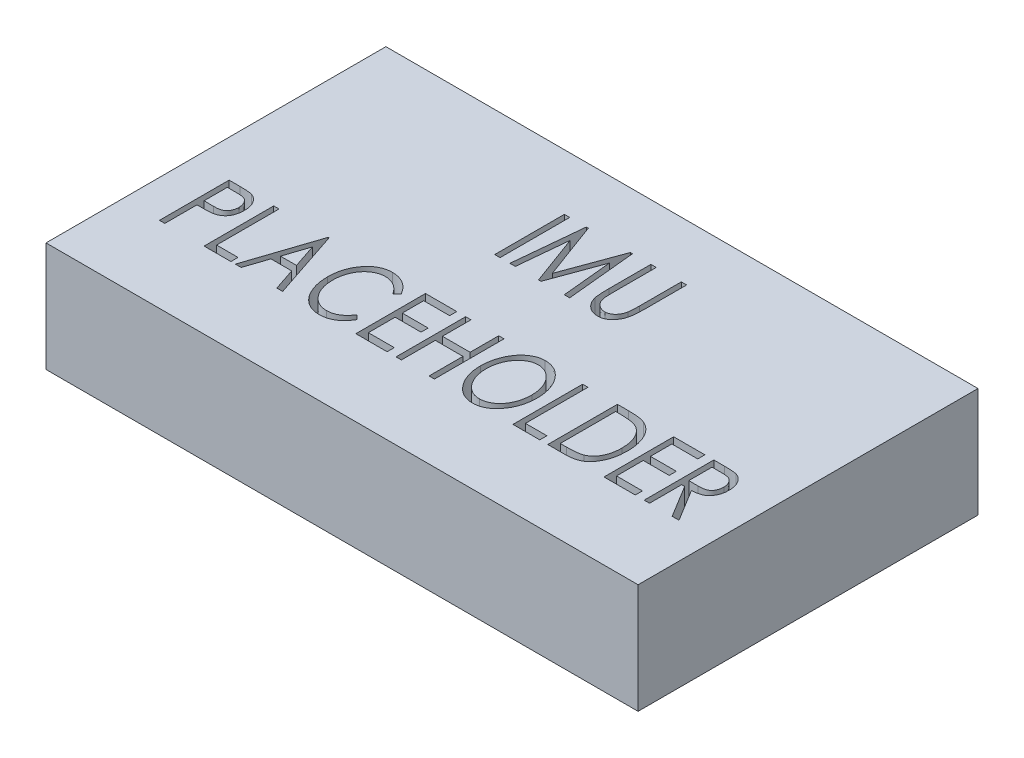
from build123d import *

# Parameters (mm, degrees)
SKETCH1_W           = 27
SKETCH1_H           = 15.5
BOSS_EXTRUDE1_DEPTH = 5
SKETCH2_W           = 0.244230769
SKETCH2_H           = 3.175
CUT_EXTRUDE2_DEPTH  = 2


with BuildPart() as part:
    # Sketch1 → Boss-Extrude1 (new body)
    with BuildSketch(Plane(origin=(0, 0, 0), x_dir=(1, 0, 0), z_dir=(0, 1, 0))):
        Rectangle(SKETCH1_W, SKETCH1_H)
    extrude(amount=BOSS_EXTRUDE1_DEPTH)

    # Sketch2 → Cut-Extrude2 (cut)
    # profile 1 of 14: a face of its own
    with BuildSketch(Plane(origin=(0, 5, 0), x_dir=(1, 0, 0), z_dir=(0, 1, 0))):
        with Locations((-2.686538462, 3.608407858)):
            Rectangle(SKETCH2_W, SKETCH2_H)
    # profile 2 of 14: a face of its own
    with BuildSketch(Plane(origin=(0, 5, 0), x_dir=(1, 0, 0), z_dir=(0, 1, 0))):
        Polygon((-2.116666667, 2.020907858), (-1.808198117, 5.195907858), (-1.715975561, 5.195907858), (-0.753044872, 2.590779652), (0.204161659, 5.195907858), (0.300200321, 5.195907858), (0.610576923, 2.020907858), (0.365710136, 2.020907858), (0.142467949, 4.300395037), (-0.69453125, 2.020907858), (-0.806470353, 2.020907858), (-1.648557692, 4.300395037), (-1.869891827, 2.020907858), align=None)
    # profile 3 of 14: a face of its own
    with BuildSketch(Plane(origin=(0, 5, 0), x_dir=(1, 0, 0), z_dir=(0, 1, 0))):
        with BuildLine():
            Line((1.13974359, 5.195907858), (1.383974359, 5.195907858))
            Line((1.383974359, 5.195907858), (1.383974359, 3.293579132))
            add(Edge.make_bspline(
                [(1.383974359, 3.293579132), (1.383901601, 3.266653956), (1.38376353, 3.215558796), (1.38468575, 3.142844249), (1.384960193, 3.078172474), (1.386552348, 3.021365839), (1.387412081, 2.972579182), (1.389649815, 2.931685992), (1.391053297, 2.898762782), (1.393220111, 2.879525012), (1.394150641, 2.871263426)],
                knots=[0, 0, 0, 0, 1.529155413, 2.901835916, 4.130035505, 5.201918895, 6.129357308, 6.900801451, 7.527953438, 8, 8, 8, 8], degree=3))
            add(Edge.make_bspline(
                [(1.394150641, 2.871263426), (1.397638099, 2.841497304), (1.404389282, 2.783874673), (1.422944611, 2.701921793), (1.447056836, 2.627238344), (1.477385635, 2.559486969), (1.516615291, 2.49843915), (1.563774858, 2.442662014), (1.62086562, 2.392941459), (1.68457317, 2.348283085), (1.753537826, 2.312078813), (1.823825711, 2.284865947), (1.894539001, 2.268027358), (1.941887209, 2.266094274), (1.965294471, 2.265138627)],
                knots=[0, 0, 0, 0, 1.17424895, 2.273165188, 3.287688819, 4.247239277, 5.174089139, 6.123362021, 7.100708873, 8.13362008, 9.16716642, 10.145784664, 11.083342199, 12, 12, 12, 12], degree=3))
            add(Edge.make_bspline(
                [(1.965294471, 2.265138627), (1.985482607, 2.266123244), (2.025995245, 2.268099129), (2.086156794, 2.280164509), (2.144388713, 2.30190322), (2.201341536, 2.330306638), (2.254622254, 2.367148599), (2.304463064, 2.410144868), (2.348770019, 2.460142783), (2.38908455, 2.515909251), (2.42521768, 2.577817865), (2.454135403, 2.64683626), (2.480652, 2.721066018), (2.492279421, 2.773577992), (2.498277244, 2.80066547)],
                knots=[0, 0, 0, 0, 0.887425244, 1.780844861, 2.682628156, 3.611715659, 4.570365192, 5.521242685, 6.497608697, 7.498294315, 8.541734898, 9.639015203, 10.782123018, 12, 12, 12, 12], degree=3))
            add(Edge.make_bspline(
                [(2.498277244, 2.80066547), (2.500234115, 2.811892449), (2.504615686, 2.837030439), (2.510663698, 2.878947065), (2.51350359, 2.928936188), (2.518033307, 2.986534558), (2.519784163, 3.052110555), (2.523118075, 3.125641188), (2.522927047, 3.207084936), (2.523446561, 3.263899797), (2.523717949, 3.293579132)],
                knots=[0, 0, 0, 0, 0.553535321, 1.239404254, 2.05518318, 2.983939725, 4.045295254, 5.240417841, 6.558430678, 8, 8, 8, 8], degree=3))
            Line((2.523717949, 3.293579132), (2.523717949, 5.195907858))
            Line((2.523717949, 5.195907858), (2.767948718, 5.195907858))
            Line((2.767948718, 5.195907858), (2.767948718, 3.278314708))
            add(Edge.make_bspline(
                [(2.767948718, 3.278314708), (2.767594153, 3.243757309), (2.766902337, 3.176330113), (2.764725376, 3.077489597), (2.759526419, 2.983761389), (2.75252082, 2.895122862), (2.744016294, 2.811681062), (2.732050959, 2.733338093), (2.71999952, 2.659737959), (2.699700711, 2.569506319), (2.66693094, 2.462886029), (2.609521604, 2.343588651), (2.536151615, 2.232788723), (2.463431973, 2.148099074), (2.397611481, 2.087897758), (2.34523872, 2.048284406), (2.29046296, 2.014301465), (2.232895373, 1.98673133), (2.172836127, 1.96594694), (2.110549565, 1.950282872), (2.045474299, 1.941453146), (2.001148753, 1.940155988), (1.978650841, 1.939497601)],
                knots=[0, 0, 0, 0, 1.189495296, 2.320901874, 3.402429694, 4.419879292, 5.381225388, 6.288312168, 7.147249289, 7.947424288, 9.470551633, 10.975160932, 12.486972232, 14.033533548, 14.803182079, 15.553316057, 16.290454294, 17.018287978, 17.745243254, 18.474392565, 19.22566139, 20, 20, 20, 20], degree=3))
            add(Edge.make_bspline(
                [(1.978650841, 1.939497601), (1.954251596, 1.940203216), (1.906373705, 1.941587823), (1.835615718, 1.949721037), (1.767883662, 1.96464499), (1.702238619, 1.984011007), (1.640023716, 2.010677691), (1.57963415, 2.041384587), (1.52312185, 2.079809387), (1.468329122, 2.121844953), (1.417761385, 2.169650135), (1.37106062, 2.221249963), (1.329084566, 2.277022808), (1.290771322, 2.335862825), (1.257606254, 2.399058462), (1.228318357, 2.465443669), (1.204120362, 2.535994068), (1.191378299, 2.584543797), (1.184900841, 2.609224164)],
                knots=[0, 0, 0, 0, 1.040046564, 2.040851474, 3.029716458, 3.992945491, 4.952778378, 5.910567797, 6.875363504, 7.860382118, 8.851185287, 9.836411077, 10.823085881, 11.82307474, 12.825469039, 13.861228841, 14.912750729, 16, 16, 16, 16], degree=3))
            add(Edge.make_bspline(
                [(1.184900841, 2.609224164), (1.181064958, 2.626141417), (1.172725329, 2.662921369), (1.164528043, 2.72358367), (1.156905257, 2.793352238), (1.150660704, 2.872472855), (1.145722611, 2.960690267), (1.14177146, 3.058220269), (1.140125717, 3.165097736), (1.139874538, 3.239517397), (1.13974359, 3.278314708)],
                knots=[0, 0, 0, 0, 0.619449711, 1.346751184, 2.18483435, 3.12705977, 4.181588362, 5.341301494, 6.613936809, 8, 8, 8, 8], degree=3))
            Line((1.13974359, 3.278314708), (1.13974359, 5.195907858))
        make_face()
    # profile 4 of 14: a face of its own
    with BuildSketch(Plane(origin=(0, 5, 0), x_dir=(1, 0, 0), z_dir=(0, 1, 0))):
        with BuildLine():
            Line((-11.804487179, -1.095758809), (-11.311573518, -1.095758809))
            add(Edge.make_bspline(
                [(-11.311573518, -1.095758809), (-11.277650217, -1.0958047), (-11.212760895, -1.095892482), (-11.119681876, -1.098635016), (-11.035067755, -1.102296341), (-10.959151727, -1.107333764), (-10.891827819, -1.113307359), (-10.833341168, -1.121817611), (-10.782956866, -1.130483375), (-10.752878224, -1.139395024), (-10.739157652, -1.143460131)],
                knots=[0, 0, 0, 0, 1.413289242, 2.703374391, 3.879342949, 4.941642004, 5.873291596, 6.693989754, 7.404254793, 8, 8, 8, 8], degree=3))
            add(Edge.make_bspline(
                [(-10.739157652, -1.143460131), (-10.721625909, -1.149453973), (-10.686941343, -1.161312109), (-10.637561439, -1.18552549), (-10.590394978, -1.213373381), (-10.545675887, -1.245978535), (-10.503605399, -1.283289106), (-10.463359562, -1.324358242), (-10.426548805, -1.37081777), (-10.391580391, -1.420740773), (-10.359820606, -1.474608775), (-10.332201755, -1.532218918), (-10.309795105, -1.593312171), (-10.290103095, -1.657495721), (-10.276101852, -1.725281373), (-10.264986145, -1.796346846), (-10.258623845, -1.870734857), (-10.25800678, -1.921510042), (-10.257692308, -1.947386413)],
                knots=[0, 0, 0, 0, 0.884746594, 1.750370786, 2.622729615, 3.500310264, 4.390609716, 5.30783377, 6.244661446, 7.220040901, 8.219286538, 9.229974682, 10.268866035, 11.326756505, 12.435726026, 13.573575987, 14.763430443, 16, 16, 16, 16], degree=3))
            add(Edge.make_bspline(
                [(-10.257692308, -1.947386413), (-10.257973051, -1.97347955), (-10.258521738, -2.024476075), (-10.265315137, -2.099189702), (-10.275020132, -2.170454026), (-10.289931341, -2.238155302), (-10.308181266, -2.302394757), (-10.330503415, -2.363294639), (-10.357068835, -2.420674634), (-10.388464102, -2.473980539), (-10.422824183, -2.523790687), (-10.460271006, -2.569728702), (-10.501149722, -2.611244875), (-10.545169831, -2.648399499), (-10.59256127, -2.680641993), (-10.642396031, -2.709844387), (-10.695895639, -2.733779861), (-10.733120921, -2.746707012), (-10.751878005, -2.753220748)],
                knots=[0, 0, 0, 0, 1.230348438, 2.404597596, 3.535952481, 4.620603023, 5.671397407, 6.683805958, 7.676968664, 8.649426021, 9.598095933, 10.528942615, 11.441124898, 12.342499997, 13.24120863, 14.141695784, 15.06363722, 16, 16, 16, 16], degree=3))
            add(Edge.make_bspline(
                [(-10.751878005, -2.753220748), (-10.767521165, -2.757440407), (-10.801515697, -2.766610251), (-10.857629988, -2.777069907), (-10.922794328, -2.785900375), (-10.997097432, -2.792521765), (-11.080645846, -2.798217663), (-11.173304574, -2.802686278), (-11.275094465, -2.805179278), (-11.345917098, -2.805307438), (-11.382807492, -2.805374194)],
                knots=[0, 0, 0, 0, 0.612409215, 1.330841357, 2.156118473, 3.098102871, 4.150647915, 5.322299054, 6.605227774, 8, 8, 8, 8], degree=3))
            Line((-11.382807492, -2.805374194), (-11.56025641, -2.805374194))
            Line((-11.56025641, -2.805374194), (-11.56025641, -4.270758809))
            Line((-11.56025641, -4.270758809), (-11.804487179, -4.270758809))
            Line((-11.804487179, -4.270758809), (-11.804487179, -1.095758809))
        make_face()
        with BuildLine():
            Line((-11.56025641, -1.421399835), (-11.56025641, -2.479733168))
            Line((-11.56025641, -2.479733168), (-11.135396635, -2.486729362))
            add(Edge.make_bspline(
                [(-11.135396635, -2.486729362), (-11.114613281, -2.486746959), (-11.074502995, -2.48678092), (-11.016416138, -2.483107806), (-10.962699372, -2.479079784), (-10.913221983, -2.472732186), (-10.868302904, -2.464321609), (-10.827240387, -2.455352158), (-10.791072822, -2.442982352), (-10.748280415, -2.425444166), (-10.700664893, -2.39648155), (-10.64938471, -2.353616307), (-10.606349931, -2.30024019), (-10.568604252, -2.240032663), (-10.539444831, -2.172963444), (-10.517290159, -2.101608603), (-10.504595936, -2.026279788), (-10.502822587, -1.974780739), (-10.501923077, -1.948658449)],
                knots=[0, 0, 0, 0, 1.042081371, 2.011137451, 2.917996092, 3.743607318, 4.511095698, 5.210044043, 5.848905295, 6.425539579, 7.526959198, 8.628378818, 9.761072847, 10.950155818, 12.183071426, 13.417453374, 14.690033403, 16, 16, 16, 16], degree=3))
            add(Edge.make_bspline(
                [(-10.501923077, -1.948658449), (-10.502826006, -1.923169692), (-10.504613141, -1.8727207), (-10.517399636, -1.798695877), (-10.539368014, -1.728108192), (-10.568913423, -1.661829696), (-10.605241145, -1.601772987), (-10.647691305, -1.549945371), (-10.695587711, -1.507150858), (-10.741281864, -1.480148624), (-10.781666948, -1.463027254), (-10.816365665, -1.451835028), (-10.855470261, -1.442257012), (-10.899082462, -1.434885742), (-10.947006119, -1.428481786), (-10.999644032, -1.424126187), (-11.05650454, -1.421600937), (-11.095960782, -1.421468275), (-11.116316106, -1.421399835)],
                knots=[0, 0, 0, 0, 1.311348819, 2.595506256, 3.851552363, 5.106555753, 6.32083189, 7.452254181, 8.542153451, 9.608595853, 10.16582827, 10.797158969, 11.48245446, 12.235753575, 13.072011464, 13.969832696, 14.952644476, 16, 16, 16, 16], degree=3))
            Line((-11.116316106, -1.421399835), (-11.56025641, -1.421399835))
        make_face(mode=Mode.SUBTRACT)
    # profile 5 of 14: a face of its own
    with BuildSketch(Plane(origin=(0, 5, 0), x_dir=(1, 0, 0), z_dir=(0, 1, 0))):
        Polygon((-9.769230769, -1.095758809), (-9.525, -1.095758809), (-9.525, -3.945117784), (-8.548076923, -3.945117784), (-8.548076923, -4.270758809), (-9.769230769, -4.270758809), align=None)
    # profile 6 of 14: a face of its own
    with BuildSketch(Plane(origin=(0, 5, 0), x_dir=(1, 0, 0), z_dir=(0, 1, 0))):
        Polygon((-7.245512821, -1.095758809), (-6.187179487, -4.270758809), (-6.453034856, -4.270758809), (-6.792032252, -3.253130604), (-7.739698518, -3.253130604), (-8.078695913, -4.270758809), (-8.344551282, -4.270758809), (-7.286217949, -1.095758809), align=None)
        Polygon((-7.265865385, -1.832267223), (-7.630939503, -2.927489578), (-6.900791266, -2.927489578), align=None, mode=Mode.SUBTRACT)
    # profile 7 of 14: a face of its own
    with BuildSketch(Plane(origin=(0, 5, 0), x_dir=(1, 0, 0), z_dir=(0, 1, 0))):
        with BuildLine():
            Line((-3.378525641, -1.678350957), (-3.571875, -1.869156245))
            add(Edge.make_bspline(
                [(-3.571875, -1.869156245), (-3.598776727, -1.827828197), (-3.651212922, -1.747272565), (-3.742615172, -1.639614452), (-3.842692413, -1.548458011), (-3.949947491, -1.472983585), (-4.063678733, -1.412965938), (-4.183955176, -1.371024746), (-4.309548524, -1.344416564), (-4.395384779, -1.341475841), (-4.438767027, -1.339989578)],
                knots=[0, 0, 0, 0, 1.111525425, 2.166558491, 3.175351395, 4.157123073, 5.11752335, 6.065846558, 7.022465223, 8, 8, 8, 8], degree=3))
            add(Edge.make_bspline(
                [(-4.438767027, -1.339989578), (-4.462756848, -1.340353188), (-4.51048372, -1.341076576), (-4.58121476, -1.350752718), (-4.65066021, -1.364309203), (-4.718666478, -1.384412507), (-4.785166898, -1.409817417), (-4.850833137, -1.44053858), (-4.914606586, -1.477507322), (-4.977041588, -1.519360493), (-5.03651692, -1.566444359), (-5.093191254, -1.61745779), (-5.146832491, -1.671828361), (-5.195728673, -1.7311665), (-5.242413663, -1.793164418), (-5.285102729, -1.859830344), (-5.324341611, -1.93015579), (-5.360027652, -2.004065919), (-5.391615729, -2.081028692), (-5.419871325, -2.160233997), (-5.442625577, -2.242392133), (-5.461552925, -2.326688332), (-5.47699148, -2.413235017), (-5.487752024, -2.502193861), (-5.494247063, -2.593481158), (-5.494875297, -2.655263298), (-5.495192308, -2.686438897)],
                knots=[0, 0, 0, 0, 0.907615735, 1.805668338, 2.698251542, 3.584750363, 4.486668963, 5.391547429, 6.326439657, 7.274845802, 8.235134492, 9.19572507, 10.160699102, 11.123701377, 12.104602389, 13.09764599, 14.118208251, 15.152161779, 16.20308195, 17.26679937, 18.334114781, 19.428523801, 20.537059719, 21.661122186, 22.819789684, 24, 24, 24, 24], degree=3))
            add(Edge.make_bspline(
                [(-5.495192308, -2.686438897), (-5.494507206, -2.733338956), (-5.493164458, -2.825259561), (-5.47761553, -2.959945228), (-5.45496149, -3.088866338), (-5.420498269, -3.211565915), (-5.378389455, -3.328896243), (-5.325784635, -3.440144616), (-5.264087346, -3.545479461), (-5.193078926, -3.643403541), (-5.115405959, -3.733068496), (-5.031579241, -3.811561366), (-4.942273313, -3.877764875), (-4.848485789, -3.932159058), (-4.749500912, -3.974862791), (-4.645309064, -4.004200443), (-4.536386559, -4.023767591), (-4.461962893, -4.025597849), (-4.424138622, -4.02652804)],
                knots=[0, 0, 0, 0, 1.176544319, 2.305938824, 3.398675503, 4.458528894, 5.500492725, 6.524019327, 7.54247104, 8.560018829, 9.555640471, 10.515690316, 11.436249321, 12.339796262, 13.231324186, 14.133993287, 15.051641147, 16, 16, 16, 16], degree=3))
            add(Edge.make_bspline(
                [(-4.424138622, -4.02652804), (-4.382458078, -4.024986116), (-4.300036577, -4.021937026), (-4.179237675, -3.996124973), (-4.06363451, -3.954514981), (-3.953397093, -3.896010311), (-3.848949699, -3.820516139), (-3.750114942, -3.728563441), (-3.65595125, -3.620529901), (-3.600517743, -3.539321909), (-3.571875, -3.497361373)],
                knots=[0, 0, 0, 0, 0.952744079, 1.884010888, 2.812241363, 3.756054432, 4.729234272, 5.752103472, 6.83850172, 8, 8, 8, 8], degree=3))
            Line((-3.571875, -3.497361373), (-3.378525641, -3.686258609))
            add(Edge.make_bspline(
                [(-3.378525641, -3.686258609), (-3.393722355, -3.712085134), (-3.423862162, -3.763307163), (-3.473387273, -3.836128671), (-3.525710335, -3.904433654), (-3.580670439, -3.968386121), (-3.638239542, -4.028063998), (-3.698996684, -4.083119953), (-3.762681771, -4.133259639), (-3.828758729, -4.179253079), (-3.897235339, -4.219790167), (-3.967770263, -4.25514599), (-4.040325607, -4.284918338), (-4.114812503, -4.309933016), (-4.191375628, -4.329077932), (-4.270079402, -4.342205736), (-4.350589155, -4.350892172), (-4.40503543, -4.351741892), (-4.432406851, -4.352169066)],
                knots=[0, 0, 0, 0, 1.097466587, 2.176617458, 3.223542499, 4.24784203, 5.263894416, 6.259075414, 7.248787007, 8.231127996, 9.20607359, 10.161176055, 11.11880108, 12.076583544, 13.037195505, 14.006246386, 14.997693222, 16, 16, 16, 16], degree=3))
            add(Edge.make_bspline(
                [(-4.432406851, -4.352169066), (-4.4585034, -4.351929757), (-4.510159139, -4.351456069), (-4.586336529, -4.343846607), (-4.660541811, -4.333428947), (-4.73241219, -4.317766205), (-4.802636517, -4.299310099), (-4.870213583, -4.27432687), (-4.936285478, -4.247073337), (-4.999716815, -4.21389539), (-5.061370981, -4.177358824), (-5.120721857, -4.135681954), (-5.177860573, -4.089771613), (-5.23345329, -4.040054519), (-5.286898145, -3.986010255), (-5.337844534, -3.92734979), (-5.386289434, -3.863982453), (-5.41673576, -3.819538393), (-5.432226563, -3.796925676)],
                knots=[0, 0, 0, 0, 1.046396854, 2.071247165, 3.068337592, 4.050812492, 5.020504577, 5.978187628, 6.938585804, 7.885712413, 8.846901056, 9.811882422, 10.792109303, 11.785857194, 12.802202964, 13.839086606, 14.90054771, 16, 16, 16, 16], degree=3))
            add(Edge.make_bspline(
                [(-5.432226563, -3.796925676), (-5.456887235, -3.757254183), (-5.506389729, -3.677619782), (-5.568150285, -3.550397643), (-5.621342652, -3.41762923), (-5.66442928, -3.278690298), (-5.698184744, -3.133729907), (-5.722316296, -2.982858531), (-5.736284604, -2.825779339), (-5.738364321, -2.719115462), (-5.739423077, -2.664814298)],
                knots=[0, 0, 0, 0, 0.941762336, 1.890442552, 2.848217964, 3.824856944, 4.82179242, 5.84833146, 6.904614102, 8, 8, 8, 8], degree=3))
            add(Edge.make_bspline(
                [(-5.739423077, -2.664814298), (-5.738446921, -2.607730749), (-5.736529556, -2.495607241), (-5.717793293, -2.331157035), (-5.689917835, -2.173377451), (-5.648873056, -2.022825361), (-5.596746055, -1.878810085), (-5.532323851, -1.742114728), (-5.456860742, -1.611889629), (-5.370344858, -1.490176485), (-5.275372431, -1.378843992), (-5.173297071, -1.28130339), (-5.0647812, -1.199126309), (-4.950677175, -1.131127587), (-4.830169587, -1.078462127), (-4.703816064, -1.041713075), (-4.571688337, -1.018641974), (-4.481475958, -1.015796156), (-4.435586939, -1.014348553)],
                knots=[0, 0, 0, 0, 1.169859921, 2.297838878, 3.38909346, 4.451914606, 5.49279678, 6.52526877, 7.545842673, 8.574575139, 9.582520364, 10.541746408, 11.463212457, 12.367418115, 13.258904221, 14.15150219, 15.059710529, 16, 16, 16, 16], degree=3))
            add(Edge.make_bspline(
                [(-4.435586939, -1.014348553), (-4.407793446, -1.014783129), (-4.352715966, -1.015644316), (-4.271086354, -1.024177487), (-4.191622261, -1.038117695), (-4.114149137, -1.05752328), (-4.038329157, -1.081159142), (-3.965234854, -1.112091514), (-3.894207445, -1.14805528), (-3.824950693, -1.18851936), (-3.758318221, -1.234352121), (-3.694534251, -1.284665305), (-3.634213417, -1.339510655), (-3.576476505, -1.398386827), (-3.522061484, -1.461681179), (-3.470865749, -1.529794462), (-3.422578039, -1.601954818), (-3.393295223, -1.652737389), (-3.378525641, -1.678350957)],
                knots=[0, 0, 0, 0, 1.015828107, 2.013034202, 2.996775397, 3.9630177, 4.931247519, 5.897116707, 6.860744174, 7.840446603, 8.827236464, 9.81499991, 10.808221994, 11.805759373, 12.828042674, 13.85735367, 14.919298219, 16, 16, 16, 16], degree=3))
        make_face()
    # profile 8 of 14: a face of its own
    with BuildSketch(Plane(origin=(0, 5, 0), x_dir=(1, 0, 0), z_dir=(0, 1, 0))):
        Polygon((-2.849358974, -1.095758809), (-1.424679487, -1.095758809), (-1.424679487, -1.421399835), (-2.605128205, -1.421399835), (-2.605128205, -2.398322912), (-1.424679487, -2.398322912), (-1.424679487, -2.723963937), (-2.605128205, -2.723963937), (-2.605128205, -3.945117784), (-1.424679487, -3.945117784), (-1.424679487, -4.270758809), (-2.849358974, -4.270758809), align=None)
    # profile 9 of 14: a face of its own
    with BuildSketch(Plane(origin=(0, 5, 0), x_dir=(1, 0, 0), z_dir=(0, 1, 0))):
        Polygon((-1.017628205, -1.095758809), (-0.773397436, -1.095758809), (-0.773397436, -2.398322912), (0.488461538, -2.398322912), (0.488461538, -1.095758809), (0.732692308, -1.095758809), (0.732692308, -4.270758809), (0.488461538, -4.270758809), (0.488461538, -2.723963937), (-0.773397436, -2.723963937), (-0.773397436, -4.270758809), (-1.017628205, -4.270758809), align=None)
    # profile 10 of 14: a face of its own
    with BuildSketch(Plane(origin=(0, 5, 0), x_dir=(1, 0, 0), z_dir=(0, 1, 0))):
        with BuildLine():
            add(Edge.make_bspline(
                [(2.528170072, -1.014348553), (2.573410276, -1.015846973), (2.662542607, -1.018799162), (2.793504785, -1.041271583), (2.918204216, -1.080313773), (3.038303307, -1.132008072), (3.151338198, -1.201519221), (3.259556373, -1.284289479), (3.360938245, -1.383598084), (3.456031766, -1.495867889), (3.542326443, -1.619115296), (3.61874338, -1.750187684), (3.682740063, -1.888543106), (3.736058206, -2.033679541), (3.776608446, -2.185949514), (3.804740721, -2.345350546), (3.82334481, -2.511306246), (3.825292445, -2.624481644), (3.826282051, -2.681986774)],
                knots=[0, 0, 0, 0, 0.924077672, 1.820619477, 2.704345957, 3.588793985, 4.484676341, 5.408225969, 6.367020371, 7.378085712, 8.410352545, 9.437079119, 10.473843711, 11.520765135, 12.592473861, 13.688494999, 14.825509789, 16, 16, 16, 16], degree=3))
            add(Edge.make_bspline(
                [(3.826282051, -2.681986774), (3.825296376, -2.73906899), (3.823356672, -2.85140073), (3.804678462, -3.016285363), (3.776642837, -3.174860084), (3.73584725, -3.326836874), (3.682796708, -3.471956055), (3.619153809, -3.610983379), (3.543182544, -3.742863573), (3.456599424, -3.866570764), (3.362346205, -3.979836205), (3.261311966, -4.079067069), (3.155727795, -4.16400315), (3.043930177, -4.232405719), (2.927686467, -4.286824867), (2.805572891, -4.32398611), (2.678788821, -4.347997104), (2.592305622, -4.350766853), (2.548522636, -4.352169066)],
                knots=[0, 0, 0, 0, 1.174734241, 2.311752237, 3.411847821, 4.48752463, 5.546540565, 6.589387645, 7.631512928, 8.675236458, 9.694545695, 10.660582558, 11.586248185, 12.47779178, 13.352673572, 14.221009544, 15.099368277, 16, 16, 16, 16], degree=3))
            add(Edge.make_bspline(
                [(2.548522636, -4.352169066), (2.504102925, -4.350781937), (2.416564205, -4.348048298), (2.288119958, -4.32390359), (2.164781971, -4.286963368), (2.047118197, -4.23303107), (1.934664883, -4.164752436), (1.827876482, -4.080432326), (1.726705492, -3.981108075), (1.631452385, -3.868750247), (1.545217576, -3.745476724), (1.468769328, -3.614726658), (1.405659488, -3.476716921), (1.352250483, -3.333244938), (1.311505531, -3.183140937), (1.283511576, -3.026679119), (1.264774478, -2.864128988), (1.262841456, -2.753486532), (1.261858974, -2.697251197)],
                knots=[0, 0, 0, 0, 0.916029328, 1.805235379, 2.688326709, 3.567593798, 4.468872984, 5.39761654, 6.369240692, 7.39061962, 8.433416311, 9.470616228, 10.512145238, 11.561531085, 12.627274475, 13.717256431, 14.839768611, 16, 16, 16, 16], degree=3))
            add(Edge.make_bspline(
                [(1.261858974, -2.697251197), (1.262282661, -2.659497599), (1.263123937, -2.584533822), (1.271856569, -2.473119147), (1.285065014, -2.36359084), (1.303520147, -2.256182998), (1.326910471, -2.150783506), (1.356475937, -2.047742652), (1.390460376, -1.946459154), (1.430831503, -1.848212734), (1.474683642, -1.753273409), (1.523441133, -1.663553899), (1.574533028, -1.578435493), (1.630922362, -1.499521112), (1.690701337, -1.42549068), (1.754479298, -1.356685521), (1.821784821, -1.292818777), (1.893160652, -1.235298996), (1.966350754, -1.182788734), (2.042550035, -1.138538698), (2.11961468, -1.099815534), (2.198635074, -1.068747055), (2.279017975, -1.044313154), (2.360791574, -1.027463499), (2.443879045, -1.015779966), (2.499932532, -1.014828077), (2.528170072, -1.014348553)],
                knots=[0, 0, 0, 0, 1.165548892, 2.314321092, 3.448658809, 4.571166437, 5.678142732, 6.780580233, 7.879845021, 8.975145667, 10.058763506, 11.107348894, 12.126777312, 13.122170764, 14.099577622, 15.063118597, 16.017094101, 16.961792914, 17.891746868, 18.795549715, 19.679698158, 20.552529034, 21.414067769, 22.270442689, 23.128717112, 24, 24, 24, 24], degree=3))
        make_face()
        with BuildLine():
            add(Edge.make_bspline(
                [(2.538982372, -1.339989578), (2.51647564, -1.340361368), (2.471493201, -1.341104436), (2.404569769, -1.350788527), (2.338346448, -1.364473026), (2.273049304, -1.384118378), (2.209274781, -1.410962401), (2.145610349, -1.441731772), (2.083140529, -1.478858296), (2.022461388, -1.521564232), (1.963248227, -1.56829694), (1.907433348, -1.620037947), (1.854469697, -1.675240356), (1.805457853, -1.734766084), (1.759583681, -1.797848053), (1.716793413, -1.864907951), (1.677405005, -1.936023381), (1.642063897, -2.010938434), (1.610237313, -2.088643928), (1.582113518, -2.168800828), (1.558650962, -2.251446397), (1.539764977, -2.336237916), (1.524218794, -2.422977171), (1.513616406, -2.511955325), (1.507004928, -2.603230539), (1.506397372, -2.664802754), (1.506089744, -2.695979162)],
                knots=[0, 0, 0, 0, 0.858142747, 1.715102558, 2.575073736, 3.437514735, 4.31186347, 5.212756088, 6.134013882, 7.081088492, 8.042565498, 9.010149336, 9.982893837, 10.959666839, 11.949981133, 12.957623844, 13.993261068, 15.049918441, 16.11656253, 17.196257349, 18.289715237, 19.392708064, 20.509938589, 21.650847962, 22.81053291, 24, 24, 24, 24], degree=3))
            add(Edge.make_bspline(
                [(1.506089744, -2.695979162), (1.506789334, -2.741817543), (1.508163137, -2.831831512), (1.523571317, -2.963799331), (1.546704892, -3.090424925), (1.579929189, -3.211700065), (1.622425822, -3.327797353), (1.674918016, -3.438090428), (1.736161386, -3.543324539), (1.806910951, -3.641317422), (1.883679495, -3.73115862), (1.965331866, -3.810233025), (2.051447214, -3.87659791), (2.14136621, -3.931387156), (2.234942966, -3.974463731), (2.332973711, -4.004224194), (2.434536992, -4.023688771), (2.503910985, -4.025574651), (2.538982372, -4.02652804)],
                knots=[0, 0, 0, 0, 1.177444537, 2.312177139, 3.40960841, 4.482848825, 5.539490554, 6.582560744, 7.617904436, 8.664199621, 9.684176649, 10.651348494, 11.579811393, 12.472147848, 13.352309381, 14.219132689, 15.099698832, 16, 16, 16, 16], degree=3))
            add(Edge.make_bspline(
                [(2.538982372, -4.02652804), (2.56253977, -4.026092014), (2.609378943, -4.025225063), (2.678947924, -4.016626043), (2.747260449, -4.002716714), (2.814142219, -3.982742592), (2.879665208, -3.958000848), (2.944047103, -3.927874246), (3.006571343, -3.891572125), (3.06780973, -3.850163634), (3.126503135, -3.803850048), (3.182843485, -3.753741391), (3.23487786, -3.698658121), (3.283976945, -3.640062351), (3.329977458, -3.577469686), (3.372531916, -3.510790549), (3.411399825, -3.439726001), (3.446910162, -3.364988273), (3.478322415, -3.28690943), (3.506832678, -3.206938683), (3.529123175, -3.124204429), (3.549492763, -3.040005074), (3.563563696, -2.953192255), (3.574654694, -2.864548073), (3.581091229, -2.773669906), (3.581729294, -2.71231333), (3.582051282, -2.681350756)],
                knots=[0, 0, 0, 0, 0.896597927, 1.782705547, 2.664500824, 3.548252163, 4.437296353, 5.329230919, 6.25137377, 7.187229144, 8.141596259, 9.096202311, 10.055404798, 11.023835637, 12.00546529, 13.01090224, 14.033305449, 15.087649765, 16.159432575, 17.236763908, 18.317868849, 19.42025149, 20.533661908, 21.664060857, 22.821207218, 24, 24, 24, 24], degree=3))
            add(Edge.make_bspline(
                [(3.582051282, -2.681350756), (3.581729049, -2.650600185), (3.581090535, -2.58966714), (3.574658622, -2.49942299), (3.563552166, -2.411418008), (3.549569487, -2.325430257), (3.529118541, -2.242307456), (3.506829117, -2.1608389), (3.478325812, -2.082138093), (3.446882762, -2.005344259), (3.411365748, -1.931548533), (3.371821518, -1.861595196), (3.329176949, -1.795307913), (3.283340351, -1.732646686), (3.233612461, -1.673976722), (3.180091015, -1.619335988), (3.123386569, -1.568329929), (3.063723985, -1.521313944), (3.001884543, -1.479046054), (2.938718492, -1.441711152), (2.874252878, -1.410815308), (2.809343915, -1.384114106), (2.742978287, -1.364565922), (2.675735499, -1.350708202), (2.607735801, -1.341116639), (2.561911642, -1.340365453), (2.538982372, -1.339989578)],
                knots=[0, 0, 0, 0, 1.175746054, 2.329770965, 3.456974185, 4.567169911, 5.658498816, 6.728634852, 7.795295362, 8.856674807, 9.90091875, 10.924568154, 11.927495013, 12.913337012, 13.891146488, 14.865724416, 15.835875264, 16.80572122, 17.768118354, 18.69828985, 19.608354684, 20.499556212, 21.3793278, 22.249031646, 23.123858975, 24, 24, 24, 24], degree=3))
        make_face(mode=Mode.SUBTRACT)
    # profile 11 of 14: a face of its own
    with BuildSketch(Plane(origin=(0, 5, 0), x_dir=(1, 0, 0), z_dir=(0, 1, 0))):
        Polygon((4.31474359, -1.095758809), (4.558974359, -1.095758809), (4.558974359, -3.945117784), (5.535897436, -3.945117784), (5.535897436, -4.270758809), (4.31474359, -4.270758809), align=None)
    # profile 12 of 14: a face of its own
    with BuildSketch(Plane(origin=(0, 5, 0), x_dir=(1, 0, 0), z_dir=(0, 1, 0))):
        with BuildLine():
            Line((5.90224359, -4.270758809), (5.90224359, -1.095758809))
            Line((5.90224359, -1.095758809), (6.412965745, -1.095758809))
            add(Edge.make_bspline(
                [(6.412965745, -1.095758809), (6.457491563, -1.096158585), (6.54339334, -1.096929855), (6.667497476, -1.101858099), (6.782301872, -1.110570401), (6.88752739, -1.123255313), (6.983391876, -1.138743693), (7.06962372, -1.158504763), (7.146642494, -1.181246455), (7.193503768, -1.20094516), (7.215619992, -1.210241982)],
                knots=[0, 0, 0, 0, 1.309430673, 2.526229238, 3.651873232, 4.694326079, 5.642438365, 6.506035363, 7.294921946, 8, 8, 8, 8], degree=3))
            add(Edge.make_bspline(
                [(7.215619992, -1.210241982), (7.244946574, -1.224338311), (7.303556708, -1.252510284), (7.386286328, -1.304255882), (7.463481953, -1.364054644), (7.536662119, -1.430445501), (7.604260618, -1.504784114), (7.667258882, -1.586433477), (7.724895916, -1.675463466), (7.777478707, -1.77169222), (7.82519822, -1.873455316), (7.865718626, -1.981033484), (7.900726936, -2.092896089), (7.929606695, -2.209650615), (7.950745393, -2.331508838), (7.966722662, -2.457978527), (7.976434716, -2.589188101), (7.977608915, -2.678154322), (7.978205128, -2.72332792)],
                knots=[0, 0, 0, 0, 0.871518369, 1.741757969, 2.608820314, 3.485545573, 4.386350893, 5.297754603, 6.246434625, 7.225407549, 8.23451574, 9.255928451, 10.303566895, 11.374260915, 12.476493082, 13.616005354, 14.789499959, 16, 16, 16, 16], degree=3))
            add(Edge.make_bspline(
                [(7.978205128, -2.72332792), (7.977753849, -2.762564328), (7.976865048, -2.839840934), (7.968730126, -2.953757451), (7.957249988, -3.064251842), (7.938971949, -3.17089024), (7.917203167, -3.274494899), (7.888838419, -3.374089039), (7.856740471, -3.470485281), (7.81895705, -3.56239303), (7.778212688, -3.649892473), (7.73306007, -3.731412095), (7.68690438, -3.808175488), (7.635134119, -3.877473413), (7.58217316, -3.941878105), (7.525841626, -4.000433458), (7.465910512, -4.052306682), (7.403103457, -4.099732358), (7.335100882, -4.140573815), (7.261295079, -4.175952988), (7.180974495, -4.204703383), (7.094500937, -4.229023164), (7.001630395, -4.248057566), (6.902140665, -4.260960315), (6.796424949, -4.269595977), (6.72378467, -4.27036407), (6.686453325, -4.270758809)],
                knots=[0, 0, 0, 0, 1.23098154, 2.424433871, 3.582218973, 4.715238027, 5.817791712, 6.902459275, 7.962719028, 9.004111742, 10.018880715, 10.989401734, 11.927272101, 12.826724728, 13.70062318, 14.54274969, 15.372568198, 16.185495768, 17.009212192, 17.85723006, 18.749544748, 19.682518575, 20.674060891, 21.721195903, 22.828875351, 24, 24, 24, 24], degree=3))
            Line((6.686453325, -4.270758809), (5.90224359, -4.270758809))
        make_face()
        with BuildLine():
            Line((6.146474359, -3.945117784), (6.430774239, -3.945117784))
            add(Edge.make_bspline(
                [(6.430774239, -3.945117784), (6.471694554, -3.944895693), (6.550162365, -3.944469818), (6.662990853, -3.940652902), (6.766078007, -3.934434981), (6.859661475, -3.925760033), (6.943448118, -3.914296618), (7.017689956, -3.901370463), (7.082098875, -3.885439734), (7.120745315, -3.871025844), (7.138661859, -3.864343545)],
                knots=[0, 0, 0, 0, 1.371756857, 2.630447951, 3.784000471, 4.833481419, 5.780309705, 6.618141895, 7.359368634, 8, 8, 8, 8], degree=3))
            add(Edge.make_bspline(
                [(7.138661859, -3.864343545), (7.16132365, -3.854127037), (7.206338261, -3.833833312), (7.270579911, -3.796532871), (7.33069969, -3.753111107), (7.387982806, -3.704864139), (7.44009118, -3.649441969), (7.488910526, -3.588877602), (7.535346734, -3.523345022), (7.576063178, -3.451119873), (7.613841135, -3.374773729), (7.64531243, -3.293444066), (7.672773515, -3.208527434), (7.695922041, -3.119441687), (7.712781899, -3.025848092), (7.724595294, -2.928358967), (7.732638306, -2.826920256), (7.733523032, -2.757900894), (7.733974359, -2.722691902)],
                knots=[0, 0, 0, 0, 0.872846556, 1.733792719, 2.6038707, 3.475477258, 4.360440251, 5.271163554, 6.207086466, 7.177944141, 8.180505183, 9.196993831, 10.237986842, 11.314549574, 12.427638609, 13.575851325, 14.763363968, 16, 16, 16, 16], degree=3))
            add(Edge.make_bspline(
                [(7.733974359, -2.722691902), (7.733568789, -2.685572819), (7.73277281, -2.612722221), (7.724071458, -2.505749031), (7.711087355, -2.402900414), (7.691801029, -2.304205174), (7.667810578, -2.209426151), (7.638524904, -2.118615534), (7.603690328, -2.031982812), (7.562823891, -1.950173179), (7.518061311, -1.873116422), (7.468296556, -1.802404805), (7.414545686, -1.737701471), (7.356921173, -1.678818345), (7.293909197, -1.627411054), (7.227840159, -1.581037226), (7.15661658, -1.542028996), (7.106635139, -1.52103397), (7.081420272, -1.510442303)],
                knots=[0, 0, 0, 0, 1.215863483, 2.386276084, 3.514051247, 4.610658038, 5.67873613, 6.715526467, 7.734503913, 8.734748735, 9.709217586, 10.65154377, 11.564008312, 12.462834927, 13.345957941, 14.22456227, 15.104319012, 16, 16, 16, 16], degree=3))
            add(Edge.make_bspline(
                [(7.081420272, -1.510442303), (7.060755975, -1.503075427), (7.016827453, -1.487414795), (6.944653553, -1.470526545), (6.863605181, -1.455214968), (6.773200256, -1.442554602), (6.673219351, -1.43337377), (6.563988877, -1.4265331), (6.445442616, -1.421875376), (6.363361158, -1.421562359), (6.320743189, -1.421399835)],
                knots=[0, 0, 0, 0, 0.683862343, 1.453766431, 2.308522409, 3.256881265, 4.299899069, 5.439712276, 6.670658809, 8, 8, 8, 8], degree=3))
            Line((6.320743189, -1.421399835), (6.146474359, -1.421399835))
            Line((6.146474359, -1.421399835), (6.146474359, -3.945117784))
        make_face(mode=Mode.SUBTRACT)
    # profile 13 of 14: a face of its own
    with BuildSketch(Plane(origin=(0, 5, 0), x_dir=(1, 0, 0), z_dir=(0, 1, 0))):
        Polygon((8.466666667, -1.095758809), (9.891346154, -1.095758809), (9.891346154, -1.421399835), (8.710897436, -1.421399835), (8.710897436, -2.398322912), (9.891346154, -2.398322912), (9.891346154, -2.723963937), (8.710897436, -2.723963937), (8.710897436, -3.945117784), (9.891346154, -3.945117784), (9.891346154, -4.270758809), (8.466666667, -4.270758809), align=None)
    # profile 14 of 14: a face of its own
    with BuildSketch(Plane(origin=(0, 5, 0), x_dir=(1, 0, 0), z_dir=(0, 1, 0))):
        with BuildLine():
            Line((10.298397436, -1.095758809), (10.791311098, -1.095758809))
            add(Edge.make_bspline(
                [(10.791311098, -1.095758809), (10.824171738, -1.095896706), (10.887143055, -1.09616096), (10.977707965, -1.097715135), (11.059937844, -1.101981191), (11.134026703, -1.105746555), (11.199487475, -1.112558609), (11.256886117, -1.118989238), (11.305992773, -1.127649405), (11.335570244, -1.135443225), (11.349098558, -1.139008008)],
                knots=[0, 0, 0, 0, 1.406291012, 2.694895705, 3.875596585, 4.929939196, 5.86881668, 6.691431991, 7.401479668, 8, 8, 8, 8], degree=3))
            add(Edge.make_bspline(
                [(11.349098558, -1.139008008), (11.367038455, -1.14480336), (11.402955694, -1.15640616), (11.454241369, -1.180072841), (11.502966366, -1.208515998), (11.549656338, -1.240649304), (11.592921372, -1.278634563), (11.633675658, -1.320984512), (11.672871982, -1.367236031), (11.707811239, -1.418833896), (11.740768739, -1.473403449), (11.768442557, -1.531928894), (11.791967199, -1.593446558), (11.812068969, -1.657661957), (11.826193735, -1.725274625), (11.837054166, -1.795745901), (11.844464752, -1.869211213), (11.844947397, -1.919383316), (11.845192308, -1.944842343)],
                knots=[0, 0, 0, 0, 0.890219086, 1.782296258, 2.662026138, 3.55410331, 4.45596999, 5.376940187, 6.329934089, 7.316405561, 8.318020235, 9.33962404, 10.370274173, 11.428642517, 12.515222745, 13.630246086, 14.797506457, 16, 16, 16, 16], degree=3))
            add(Edge.make_bspline(
                [(11.845192308, -1.944842343), (11.844213385, -1.987098783), (11.842310125, -2.069255422), (11.824081286, -2.188527108), (11.794363826, -2.300040384), (11.752556328, -2.403106937), (11.699879049, -2.496222089), (11.637165448, -2.578547675), (11.563001671, -2.647744536), (11.493138567, -2.695815832), (11.431279671, -2.726682558), (11.380988256, -2.748167653), (11.325981342, -2.764703697), (11.267290531, -2.779661074), (11.20414941, -2.790916716), (11.136838044, -2.799042501), (11.065302305, -2.80422692), (11.016258397, -2.804984399), (10.991020633, -2.805374194)],
                knots=[0, 0, 0, 0, 1.463301985, 2.845009436, 4.168980889, 5.453965417, 6.687638921, 7.866010869, 9.024897383, 10.188268473, 10.789455717, 11.41836669, 12.080505235, 12.777114878, 13.516268487, 14.300753823, 15.125575917, 16, 16, 16, 16], degree=3))
            Line((10.991020633, -2.805374194), (11.885897436, -4.270758809))
            Line((11.885897436, -4.270758809), (11.574884816, -4.270758809))
            Line((11.574884816, -4.270758809), (10.680008013, -2.805374194))
            Line((10.680008013, -2.805374194), (10.542628205, -2.805374194))
            Line((10.542628205, -2.805374194), (10.542628205, -4.270758809))
            Line((10.542628205, -4.270758809), (10.298397436, -4.270758809))
            Line((10.298397436, -4.270758809), (10.298397436, -1.095758809))
        make_face()
        with BuildLine():
            Line((10.542628205, -1.421399835), (10.542628205, -2.479733168))
            Line((10.542628205, -2.479733168), (10.974484175, -2.484185292))
            add(Edge.make_bspline(
                [(10.974484175, -2.484185292), (11.013731691, -2.483500284), (11.086885283, -2.482223496), (11.188518293, -2.471910672), (11.273984578, -2.454342959), (11.344940311, -2.428077812), (11.403384028, -2.392058466), (11.454729483, -2.348962491), (11.498546619, -2.296180443), (11.535547093, -2.235499569), (11.56390779, -2.168372842), (11.586473646, -2.097238405), (11.598063009, -2.021753729), (11.599985648, -1.970315362), (11.600961538, -1.944206325)],
                knots=[0, 0, 0, 0, 1.484503796, 2.766972155, 3.858711607, 4.777707686, 5.612610321, 6.443380992, 7.3028828, 8.195570234, 9.122302869, 10.053363384, 11.011928053, 12, 12, 12, 12], degree=3))
            add(Edge.make_bspline(
                [(11.600961538, -1.944206325), (11.600071429, -1.918715384), (11.598316963, -1.868471022), (11.585458513, -1.794880941), (11.563663732, -1.725058786), (11.533790612, -1.659767412), (11.497646467, -1.600483436), (11.455214187, -1.549208279), (11.4071617, -1.50742115), (11.362125208, -1.479976511), (11.322009854, -1.463182944), (11.287438499, -1.451600418), (11.248030867, -1.442301723), (11.204008388, -1.434935788), (11.15567042, -1.42843329), (11.102813586, -1.424161409), (11.04532091, -1.421575919), (11.005440092, -1.421460154), (10.984660457, -1.421399835)],
                knots=[0, 0, 0, 0, 1.313944225, 2.589872584, 3.837965354, 5.075530782, 6.282894025, 7.408145269, 8.493011398, 9.552186356, 10.110521641, 10.732722405, 11.429993849, 12.195550865, 13.033463864, 13.943953869, 14.928710818, 16, 16, 16, 16], degree=3))
            Line((10.984660457, -1.421399835), (10.542628205, -1.421399835))
        make_face(mode=Mode.SUBTRACT)
    extrude(amount=-CUT_EXTRUDE2_DEPTH, mode=Mode.SUBTRACT)


solid = part.part
